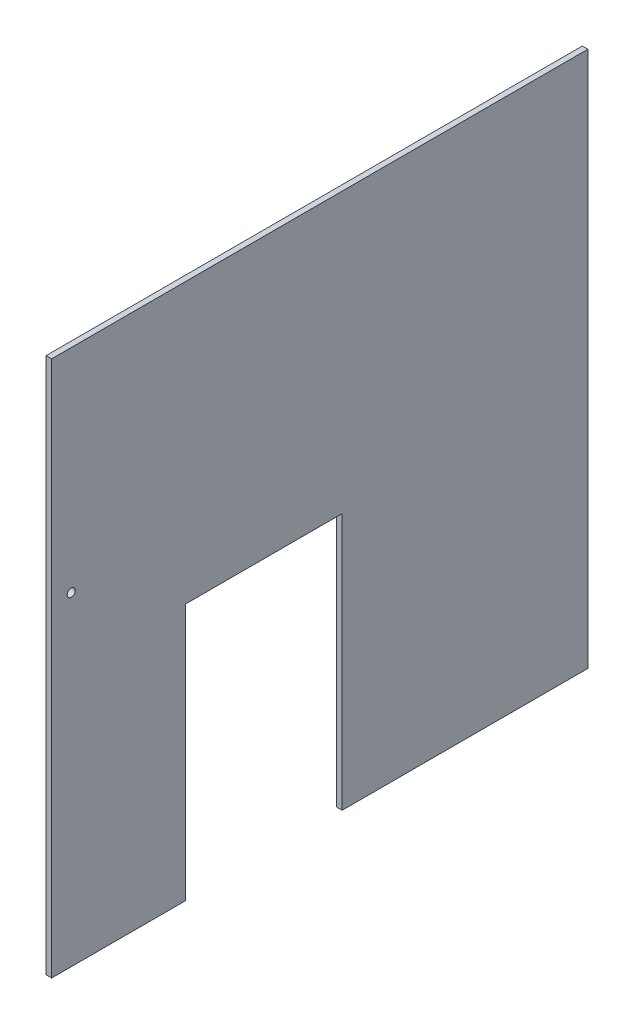
from build123d import *

# Parameters (mm, degrees)
BOSS_EXTRUDE1_DEPTH = 3.175
SKETCH2_R           = 2.286
CUT_EXTRUDE1_DEPTH  = 216.549531721


with BuildPart() as part:
    # Sketch1 → Boss-Extrude1 (new body)
    with BuildSketch(Plane(origin=(0, 0, 0), x_dir=(0, 0, -1), z_dir=(1, 0, 0))):
        Polygon((152.4, 152.4), (-152.4, 152.4), (-152.4, -152.4), (-76.2, -152.4), (-76.2, -6.35), (12.7, -6.35), (12.7, -152.4), (152.4, -152.4), align=None)
    extrude(amount=BOSS_EXTRUDE1_DEPTH)

    # Sketch2 → Cut-Extrude1 (cut, through all)
    with BuildSketch(Plane(origin=(3.175, 0, 0), x_dir=(0, 0, -1), z_dir=(1, 0, 0))):
        with Locations((-141.2875, 31.75)):
            Circle(SKETCH2_R)
    extrude(amount=-CUT_EXTRUDE1_DEPTH, mode=Mode.SUBTRACT)


solid = part.part
